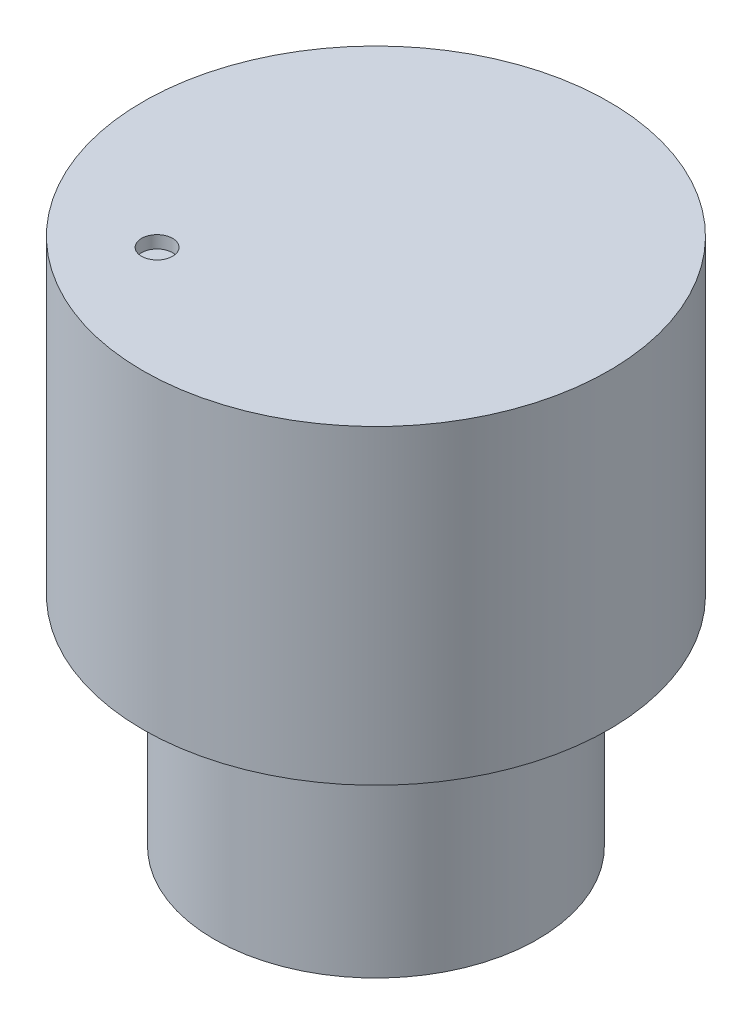
from build123d import *

# Parameters (mm, degrees)
SKETCH1_R           = 5.2
SKETCH1_R_2         = 3.2
BOSS_EXTRUDE1_DEPTH = 7
SKETCH2_R           = 7.5
BOSS_EXTRUDE2_DEPTH = 10
BOSS_EXTRUDE3_START = 1
BOSS_EXTRUDE3_DEPTH = 1
BOSS_EXTRUDE4_START = 5
BOSS_EXTRUDE4_DEPTH = 5
SKETCH5_R           = 0.5
CUT_EXTRUDE1_DEPTH  = 0.4


with BuildPart() as part:
    # Sketch1 → Boss-Extrude1 (new body)
    with BuildSketch(Plane(origin=(0, 0, 0), x_dir=(1, 0, 0), z_dir=(0, 1, 0))):
        with Locations(Location((0, 0, 0), (0, 0, 270))):
            Circle(SKETCH1_R)
        with Locations(Location((0, 0, 0), (0, 0, 270))):
            Circle(SKETCH1_R_2, mode=Mode.SUBTRACT)
    extrude(amount=BOSS_EXTRUDE1_DEPTH)

    # Sketch2 → Boss-Extrude2 (add)
    with BuildSketch(Plane(origin=(0, 7, 0), x_dir=(1, 0, 0), z_dir=(0, 1, 0))):
        with Locations(Location((0, 0, 0), (0, 0, 270))):
            Circle(SKETCH2_R)
    extrude(amount=BOSS_EXTRUDE2_DEPTH)

    # Sketch3 → Boss-Extrude3 (add)
    with BuildSketch(Plane.XZ.offset(-7).offset(BOSS_EXTRUDE3_START)):
        with BuildLine():
            Line((3.174901573, 0.4), (-3.174901573, 0.4))
            ThreePointArc((-3.174901573, 0.4), (-3.19371923, 0.20039332), (-3.2, 0))
            ThreePointArc((-3.2, 0), (-3.19371923, -0.20039332), (-3.174901573, -0.4))
            Line((-3.174901573, -0.4), (3.174901573, -0.4))
            ThreePointArc((3.174901573, -0.4), (3.19371923, -0.20039332), (3.2, 0))
            ThreePointArc((3.2, 0), (3.19371923, 0.20039332), (3.174901573, 0.4))
        make_face()
    extrude(amount=-BOSS_EXTRUDE3_DEPTH)

    # Sketch4 → Boss-Extrude4 (add)
    with BuildSketch(Plane.XZ.offset(-7).offset(BOSS_EXTRUDE4_START)):
        with BuildLine():
            Line((2.645751311, -1.8), (-2.645751311, -1.8))
            ThreePointArc((-2.645751311, -1.8), (0, -3.2), (2.645751311, -1.8))
        make_face()
    extrude(amount=-BOSS_EXTRUDE4_DEPTH)

    # Sketch5 → Cut-Extrude1 (cut)
    with BuildSketch(Plane(origin=(0, 17, 0), x_dir=(1, 0, 0), z_dir=(0, 1, 0))):
        with Locations(Location((-3.213938048, -3.830222216, 0), (0, 0, 270))):
            Circle(SKETCH5_R)
    extrude(amount=-CUT_EXTRUDE1_DEPTH, mode=Mode.SUBTRACT)


solid = part.part
